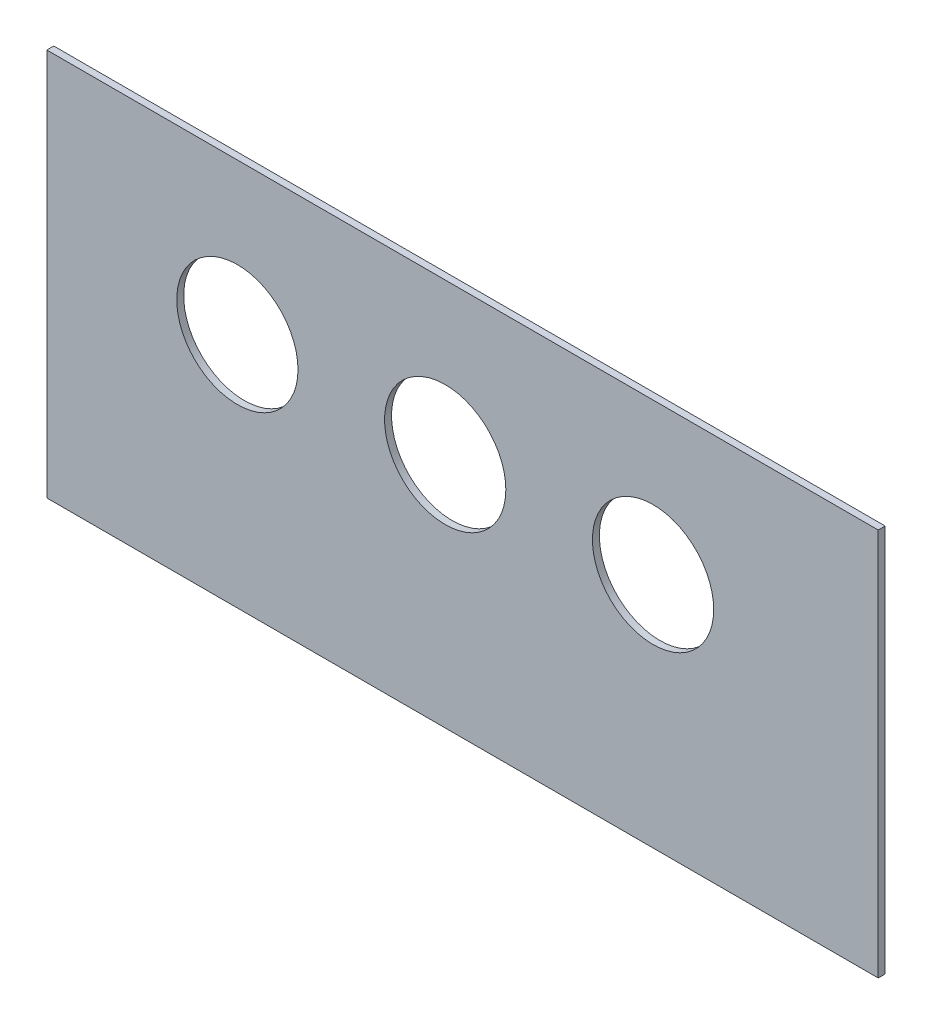
from build123d import *

# Parameters (mm, degrees)
SKETCH1_W           = 1200
SKETCH1_H           = 560
SKETCH1_R           = 87.5
BOSS_EXTRUDE1_DEPTH = 10


with BuildPart() as part:
    # Sketch1 → Boss-Extrude1 (new body)
    with BuildSketch(Plane.XY):
        with Locations((-125, -61.777108434)):
            Rectangle(SKETCH1_W, SKETCH1_H)
        with Locations((150, 0)):
            Circle(SKETCH1_R, mode=Mode.SUBTRACT)
        with Locations((-150, 0)):
            Circle(SKETCH1_R, mode=Mode.SUBTRACT)
        with Locations((-450, 0)):
            Circle(SKETCH1_R, mode=Mode.SUBTRACT)
    extrude(amount=BOSS_EXTRUDE1_DEPTH)


solid = part.part
